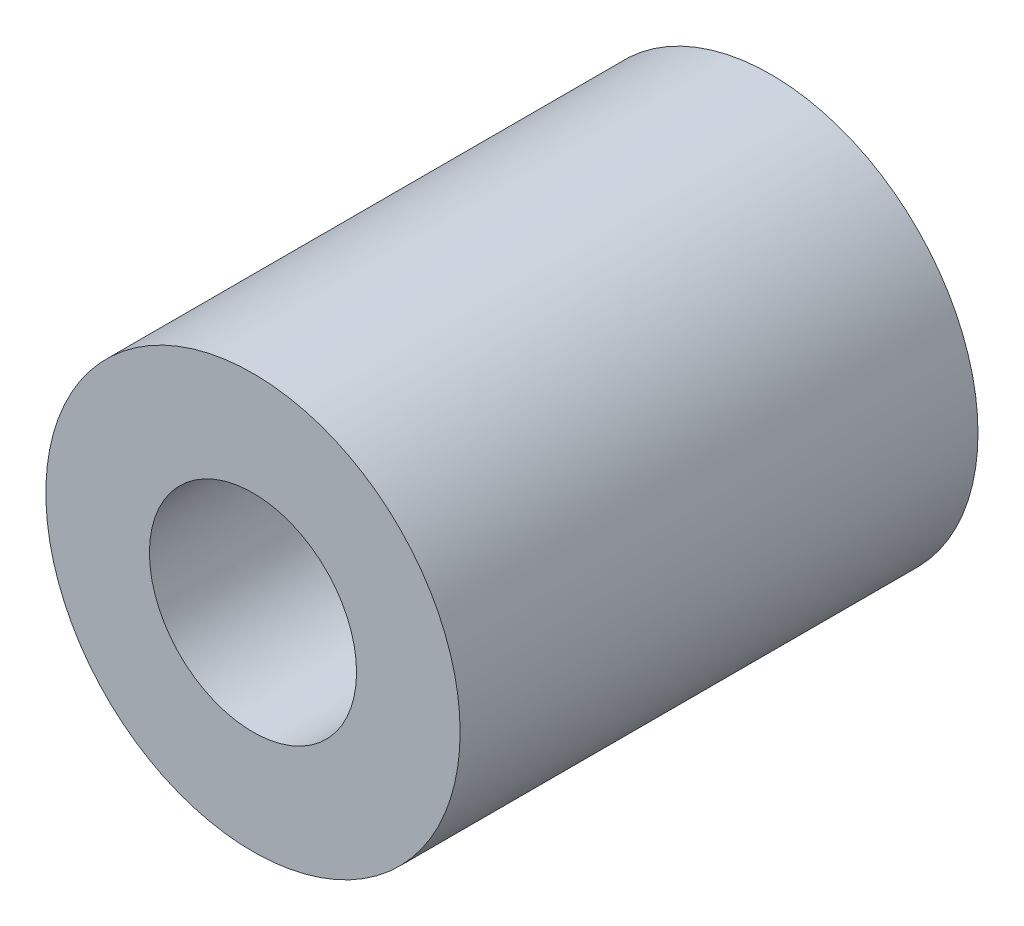
from build123d import *

# Parameters (mm, degrees)
SKETCH_1_R      = 4
SKETCH_1_R_2    = 2
EXTRUDE_1_DEPTH = 5


with BuildPart() as part:
    # 草图1 → 凸台-拉伸1 (new, symmetric)
    with BuildSketch(Plane.XY):
        Circle(SKETCH_1_R)
        Circle(SKETCH_1_R_2, mode=Mode.SUBTRACT)
    extrude(amount=EXTRUDE_1_DEPTH, both=True)


solid = part.part
